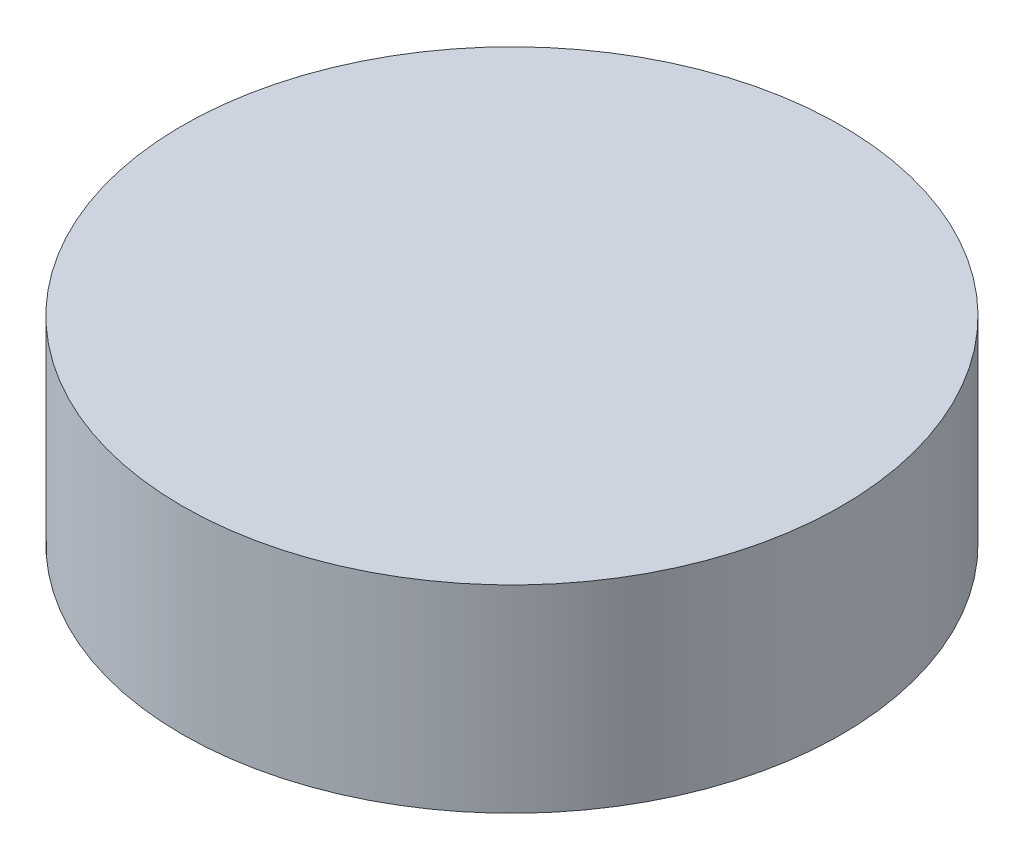
from build123d import *

# Parameters (mm, degrees)
SKETCH_1_R      = 5
EXTRUDE_1_DEPTH = 3


with BuildPart() as part:
    # 草图1 → 凸台-拉伸1 (new body)
    with BuildSketch(Plane(origin=(0, 0, 0), x_dir=(1, 0, 0), z_dir=(0, 1, 0))):
        with Locations(Location((0, 0, 0), (0, 0, 270))):
            Circle(SKETCH_1_R)
    extrude(amount=EXTRUDE_1_DEPTH)


solid = part.part
